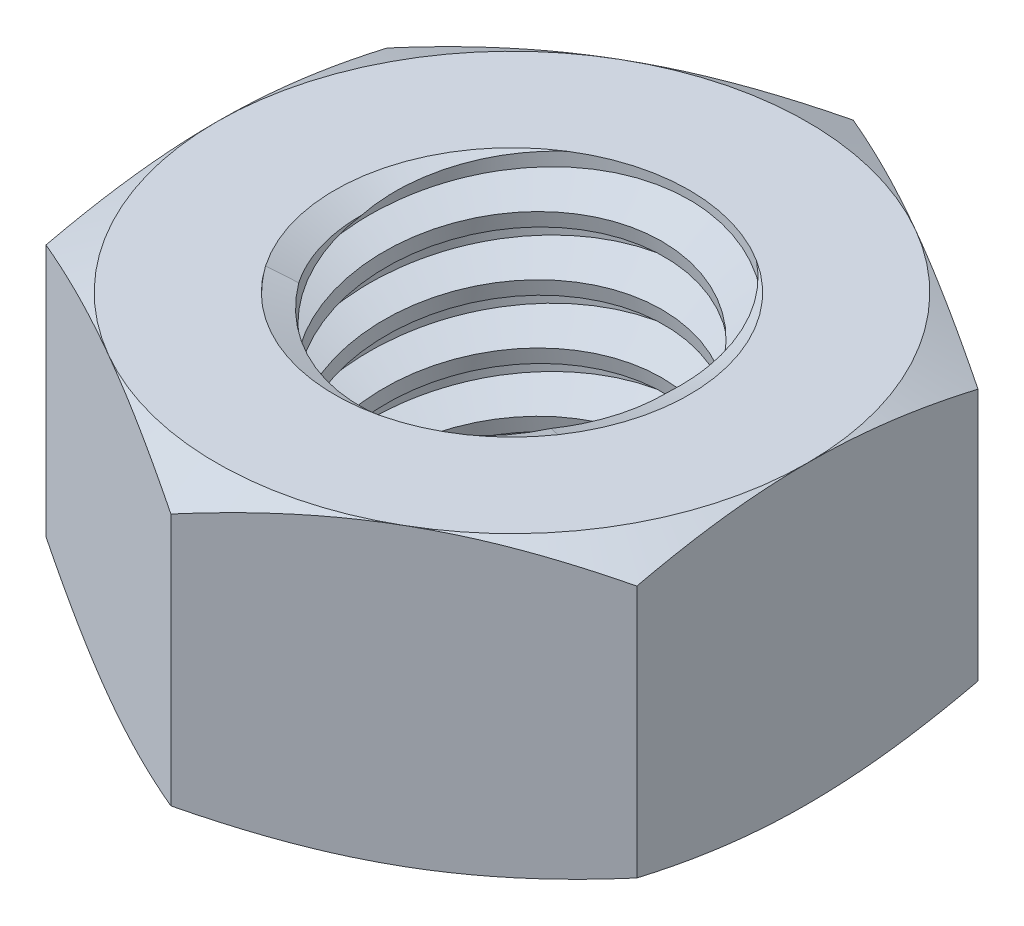
from build123d import *

# Parameters (mm, degrees)
EXTRUDE1_DEPTH      = 2.5
SKETCH2_W           = 3
SKETCH2_H           = 5
LPATTERN1_COUNT     = 5
LPATTERN1_PITCH     = 1
LPATTERN1_COL_COUNT = 2
LPATTERN1_COL_PITCH = 1


with BuildPart() as part:
    # Sketch1 → Extrude1 (new, symmetric)
    with BuildSketch(Plane(origin=(0, 0, 0), x_dir=(1, 0, 0), z_dir=(0, 1, 0))):
        Polygon((0, 5.773502692), (-5, 2.886751346), (-5, -2.886751346), (0, -5.773502692), (5, -2.886751346), (5, 2.886751346), align=None)
    extrude(amount=EXTRUDE1_DEPTH, both=True)

    # Sketch4 → Cut-Revolve2 (revolve, cut)
    with BuildSketch(Plane(origin=(0, 0, 0), x_dir=(0, 0, -1), z_dir=(1, 0, 0))):
        Polygon((0, 2.5), (3, 2.5), (2.538023184, 2.284576673), (2.538023184, -2.284576673), (3, -2.5), (0, -2.5), align=None)
    revolve(axis=Axis((0, 2.5, 0), (0, 1, 0)), mode=Mode.SUBTRACT)


with BuildPart() as body_2:
    # Sketch2 → Revolve1 (revolve)
    with BuildSketch(Plane(origin=(0, 0, 0), x_dir=(0, 0, -1), z_dir=(1, 0, 0))):
        with Locations((1.5, 0)):
            Rectangle(SKETCH2_W, SKETCH2_H)
    revolve(axis=Axis((0, -5.5, 0), (0, 1, 0)))

    # Sketch3 → Cut-Revolve1 (revolve, cut)
    with BuildSketch(Plane(origin=(0, 0, 0), x_dir=(0, 0, -1), z_dir=(1, 0, 0)), mode=Mode.PRIVATE) as cut_revolve1_sk:
        Polygon((3.020549873, 2.37670076), (3.164398987, 1.513606076), (2.579122931, 1.732870615), (2.538023184, 1.979469096), align=None)
    cut_revolve1 = revolve(cut_revolve1_sk.sketch.rotate(Axis((0, 2.5, 0.178376498), (0, -0.9863939238321437, -0.16439898730535749)), 180), axis=Axis((0, 2.5, 0.178376498), (0, -0.9863939238321437, -0.16439898730535749)), mode=Mode.SUBTRACT)

    # LPattern1: Cut-Revolve1 ×5
    with Locations(*[(0, -i * LPATTERN1_PITCH, 0) for i in range(1, LPATTERN1_COUNT)]):
        add(cut_revolve1, mode=Mode.SUBTRACT)

    # LPattern1 col: Cut-Revolve1 ×2
    with Locations(*[(0, i * LPATTERN1_COL_PITCH, 0) for i in range(1, LPATTERN1_COL_COUNT)]):
        add(cut_revolve1, mode=Mode.SUBTRACT)


with BuildPart() as part_1:
    add(part.part)

    # Combine1: cut body 2
    add(body_2.part, mode=Mode.SUBTRACT)

    # Sketch5 → Cut-Revolve3 (revolve, cut)
    with BuildSketch(Plane(origin=(0, 0, 0), x_dir=(0, 0, -1), z_dir=(1, 0, 0)), mode=Mode.PRIVATE) as cut_revolve3_sk:
        Polygon((0, -2.5), (5, -2.5), (5.773502692, -2.139309771), (5.773502692, 2.139309771), (5, 2.5), (0, 2.5), (0, 3.77), (7.043502692, 3.77), (7.043502692, -3.77), (0, -3.77), align=None)
    revolve(cut_revolve3_sk.sketch.rotate(Axis((0, -2.5, 0), (0, 1, 0)), 55.157981045), axis=Axis((0, -2.5, 0), (0, 1, 0)), mode=Mode.SUBTRACT)


solid = part_1.part
